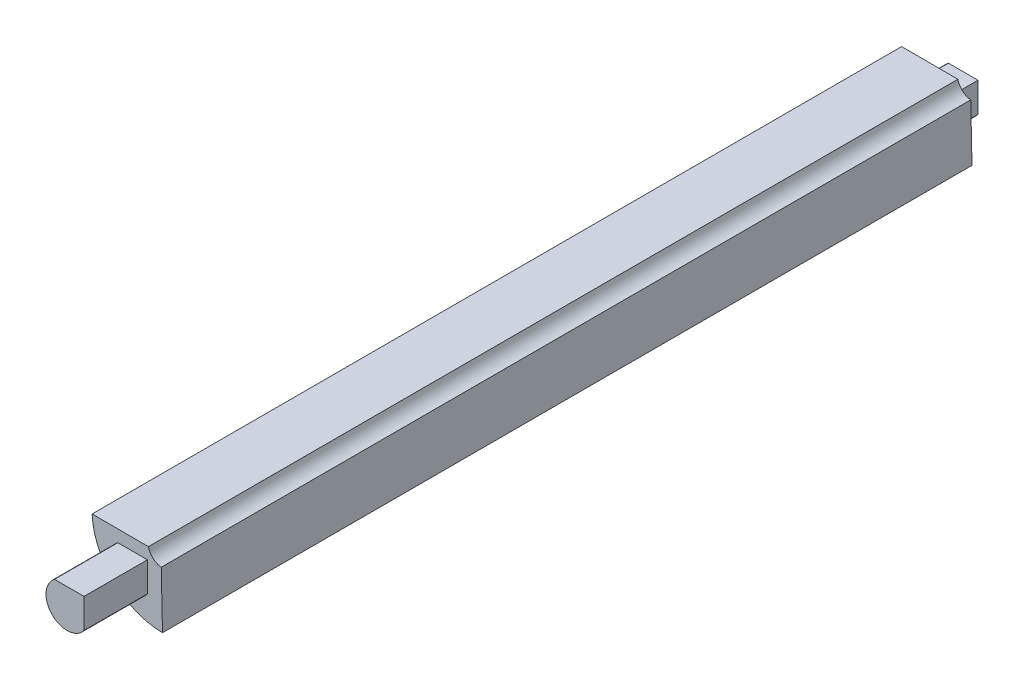
from build123d import *

# Parameters (mm, degrees)
BOSS_EXTRUDE1_DEPTH      = 115
BOSS_EXTRUDE2_DEPTH      = 9
BOSS_EXTRUDE2_DEPTH_BACK = 118


with BuildPart() as part:
    # Sketch1 → Boss-Extrude1 (new body)
    with BuildSketch(Plane.XY):
        with BuildLine():
            Line((4.673790886, -4.96994292), (4.494306077, 3.000557085))
            ThreePointArc((4.494306077, 3.000557085), (3.322885957, 3.518832419), (2.673764356, 4.623131094))
            Line((2.673764356, 4.623131094), (-5.326209114, 4.643733806))
            ThreePointArc((-5.326209114, 4.643733806), (-2.250970398, -2.165211908), (4.673790886, -4.96994292))
        make_face()
    extrude(amount=BOSS_EXTRUDE1_DEPTH)

    # Sketch2 → Boss-Extrude2 (add, two sides: drawn at the far end of the back side and taken through both)
    with BuildSketch(Plane.XY.offset(115).offset(-BOSS_EXTRUDE2_DEPTH_BACK)):
        with BuildLine():
            Line((-1.673644669, 2.929860911), (2.526355331, 2.929860911))
            Line((2.526355331, 2.929860911), (2.526355331, -1.270139089))
            ThreePointArc((2.526355331, -1.270139089), (-2.001840649, -1.598335069), (-1.673644669, 2.929860911))
        make_face()
    extrude(amount=BOSS_EXTRUDE2_DEPTH + BOSS_EXTRUDE2_DEPTH_BACK)


solid = part.part
